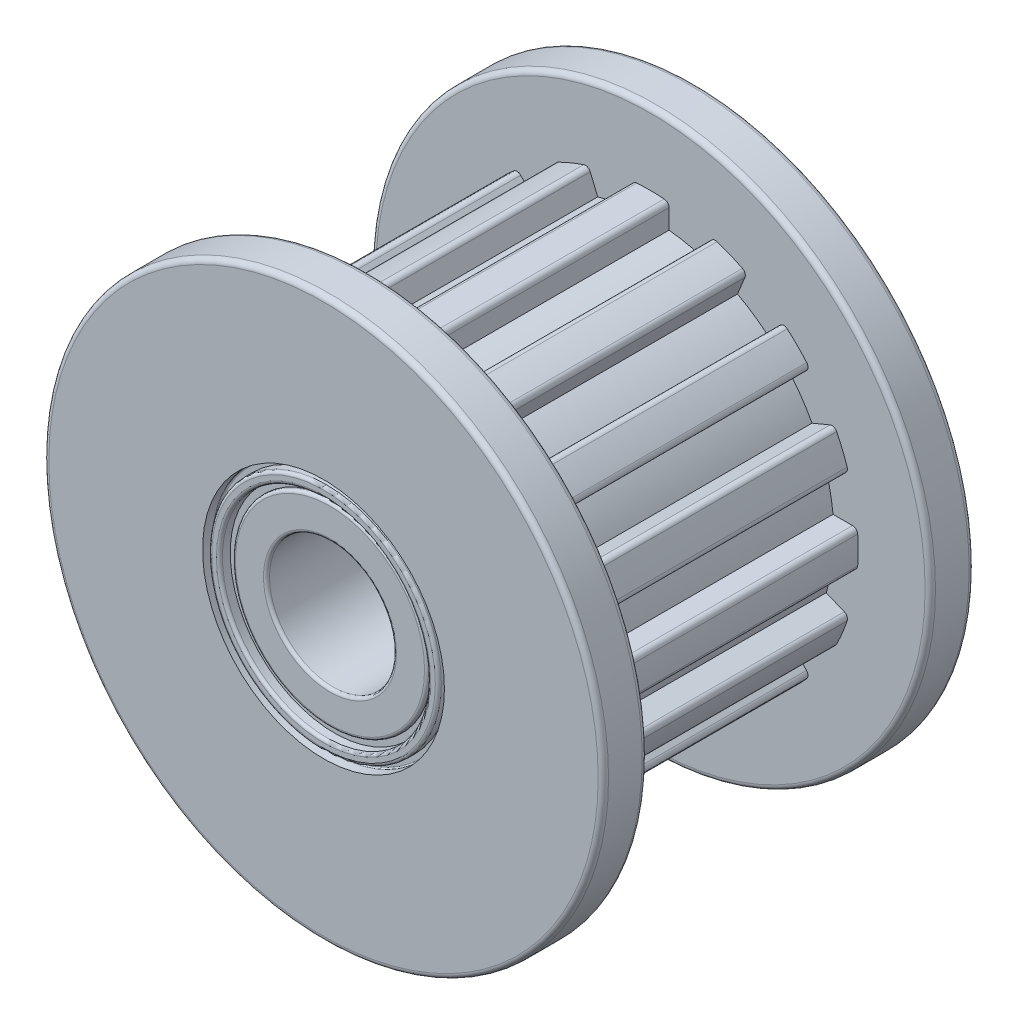
from build123d import *

# Parameters (mm, degrees)
RESSALTO_EXTRUS_O3_DEPTH   = 6.55
ESBO_O3_R                  = 6.48
RESSALTO_EXTRUS_O4_DEPTH   = 1.02
RESSALTO_EXTRUS_O5_START   = 1.02
ESBO_O4_R                  = 6.48
RESSALTO_EXTRUS_O5_DEPTH   = 1.02
FILETE2_R                  = 0.12
CORTE_EXTRUS_O1_DEPTH      = 10
CORTE_EXTRUS_O1_DEPTH_BACK = 10.02
ESBO_O5_R                  = 1.47
ESBO_O6_R                  = 2.26
CORTE_EXTRUS_O3_DEPTH      = 0.15
CORTE_EXTRUS_O4_START      = -0.15
ESBO_O8_R                  = 2.26
CORTE_EXTRUS_O4_DEPTH      = 0.15
ESBO_O9_R                  = 2.41
ESBO_O9_R_2                = 2.26
CORTE_EXTRUS_O7_DEPTH      = 0.25
CORTE_EXTRUS_O8_START      = -0.25
ESBO_O11_R                 = 2.46
ESBO_O11_R_2               = 2.26
CORTE_EXTRUS_O8_DEPTH      = 0.25
FILETE4_R                  = 0.07
FILETE5_R                  = 0.07
ESBO_O12_R                 = 2.8
ESBO_O12_R_2               = 2.66
CORTE_EXTRUS_O10_DEPTH     = 0.25
FILETE6_R                  = 0.07
FILETE7_R                  = 0.03
CORTE_EXTRUS_O11_START     = -0.25
ESBO_O13_R                 = 2.8
ESBO_O13_R_2               = 2.65
CORTE_EXTRUS_O11_DEPTH     = 0.25
FILETE8_R                  = 0.03
FILETE9_R                  = 0.07


with BuildPart() as part:
    # Esboço2 → Ressalto-extrusão3 (new body)
    with BuildSketch(Plane.XY):
        with BuildLine():
            Line((-0.43, 4.679743583), (-0.43, 4.228191103))
            ThreePointArc((-0.43, 4.228191103), (-0.829133869, 4.168337442), (-1.220790485, 4.070893095))
            Line((-1.220790485, 4.070893095), (-1.393592138, 4.488073189))
            ThreePointArc((-1.393592138, 4.488073189), (-1.454894778, 4.551437584), (-1.542951268, 4.55580963))
            ThreePointArc((-1.542951268, 4.55580963), (-1.84070731, 4.443860551), (-2.130412578, 4.312475188))
            ThreePointArc((-2.130412578, 4.312475188), (-2.189586416, 4.247118343), (-2.188128536, 4.158965438))
            Line((-2.188128536, 4.158965438), (-2.015326883, 3.741785343))
            ThreePointArc((-2.015326883, 3.741785343), (-2.36117349, 3.533745852), (-2.685726685, 3.293838517))
            Line((-2.685726685, 3.293838517), (-3.005022506, 3.613134337))
            ThreePointArc((-3.005022506, 3.613134337), (-3.085907265, 3.6482159), (-3.168933963, 3.618557384))
            ThreePointArc((-3.168933963, 3.618557384), (-3.401183618, 3.401183618), (-3.618557384, 3.168933963))
            ThreePointArc((-3.618557384, 3.168933963), (-3.6482159, 3.085907265), (-3.613134337, 3.005022506))
            Line((-3.613134337, 3.005022506), (-3.293838517, 2.685726685))
            ThreePointArc((-3.293838517, 2.685726685), (-3.533745852, 2.36117349), (-3.741785343, 2.015326883))
            Line((-3.741785343, 2.015326883), (-4.158965438, 2.188128536))
            ThreePointArc((-4.158965438, 2.188128536), (-4.247118343, 2.189586416), (-4.312475188, 2.130412578))
            ThreePointArc((-4.312475188, 2.130412578), (-4.443860551, 1.84070731), (-4.55580963, 1.542951268))
            ThreePointArc((-4.55580963, 1.542951268), (-4.551437584, 1.454894778), (-4.488073189, 1.393592138))
            Line((-4.488073189, 1.393592138), (-4.070893095, 1.220790485))
            ThreePointArc((-4.070893095, 1.220790485), (-4.168337442, 0.829133869), (-4.228191103, 0.43))
            Line((-4.228191103, 0.43), (-4.679743583, 0.43))
            ThreePointArc((-4.679743583, 0.43), (-4.761744155, 0.397612249), (-4.799481158, 0.31793177))
            ThreePointArc((-4.799481158, 0.31793177), (-4.81, 0), (-4.799481158, -0.31793177))
            ThreePointArc((-4.799481158, -0.31793177), (-4.761744155, -0.397612249), (-4.679743583, -0.43))
            Line((-4.679743583, -0.43), (-4.228191103, -0.43))
            ThreePointArc((-4.228191103, -0.43), (-4.168337442, -0.829133869), (-4.070893095, -1.220790485))
            Line((-4.070893095, -1.220790485), (-4.488073189, -1.393592138))
            ThreePointArc((-4.488073189, -1.393592138), (-4.551437584, -1.454894778), (-4.55580963, -1.542951268))
            ThreePointArc((-4.55580963, -1.542951268), (-4.443860551, -1.84070731), (-4.312475188, -2.130412578))
            ThreePointArc((-4.312475188, -2.130412578), (-4.247118343, -2.189586416), (-4.158965438, -2.188128536))
            Line((-4.158965438, -2.188128536), (-3.741785343, -2.015326883))
            ThreePointArc((-3.741785343, -2.015326883), (-3.533745852, -2.36117349), (-3.293838517, -2.685726685))
            Line((-3.293838517, -2.685726685), (-3.613134337, -3.005022506))
            ThreePointArc((-3.613134337, -3.005022506), (-3.6482159, -3.085907265), (-3.618557384, -3.168933963))
            ThreePointArc((-3.618557384, -3.168933963), (-3.401183618, -3.401183618), (-3.168933963, -3.618557384))
            ThreePointArc((-3.168933963, -3.618557384), (-3.085907265, -3.6482159), (-3.005022506, -3.613134337))
            Line((-3.005022506, -3.613134337), (-2.685726685, -3.293838517))
            ThreePointArc((-2.685726685, -3.293838517), (-2.400184002, -3.507366071), (-2.097748191, -3.696207858))
            Line((-2.097748191, -3.696207858), (-2.015326883, -3.741785343))
            Line((-2.015326883, -3.741785343), (-2.188128536, -4.158965438))
            ThreePointArc((-2.188128536, -4.158965438), (-2.189586416, -4.247118343), (-2.130412578, -4.312475188))
            ThreePointArc((-2.130412578, -4.312475188), (-1.84070731, -4.443860551), (-1.542951268, -4.55580963))
            ThreePointArc((-1.542951268, -4.55580963), (-1.454894778, -4.551437584), (-1.393592138, -4.488073189))
            Line((-1.393592138, -4.488073189), (-1.220790485, -4.070893095))
            ThreePointArc((-1.220790485, -4.070893095), (-0.829133869, -4.168337442), (-0.43, -4.228191103))
            Line((-0.43, -4.228191103), (-0.43, -4.679743583))
            ThreePointArc((-0.43, -4.679743583), (-0.397612249, -4.761744155), (-0.31793177, -4.799481158))
            ThreePointArc((-0.31793177, -4.799481158), (0, -4.81), (0.31793177, -4.799481158))
            ThreePointArc((0.31793177, -4.799481158), (0.397612249, -4.761744155), (0.43, -4.679743583))
            Line((0.43, -4.679743583), (0.43, -4.228191103))
            ThreePointArc((0.43, -4.228191103), (0.829133869, -4.168337442), (1.220790485, -4.070893095))
            Line((1.220790485, -4.070893095), (1.393592138, -4.488073189))
            ThreePointArc((1.393592138, -4.488073189), (1.454894778, -4.551437584), (1.542951268, -4.55580963))
            ThreePointArc((1.542951268, -4.55580963), (1.84070731, -4.443860551), (2.130412578, -4.312475188))
            ThreePointArc((2.130412578, -4.312475188), (2.189586416, -4.247118343), (2.188128536, -4.158965438))
            Line((2.188128536, -4.158965438), (2.015326883, -3.741785343))
            ThreePointArc((2.015326883, -3.741785343), (2.36117349, -3.533745852), (2.685726685, -3.293838517))
            Line((2.685726685, -3.293838517), (3.005022506, -3.613134337))
            ThreePointArc((3.005022506, -3.613134337), (3.085907265, -3.6482159), (3.168933963, -3.618557384))
            ThreePointArc((3.168933963, -3.618557384), (3.401183618, -3.401183618), (3.618557384, -3.168933963))
            ThreePointArc((3.618557384, -3.168933963), (3.6482159, -3.085907265), (3.613134337, -3.005022506))
            Line((3.613134337, -3.005022506), (3.293838517, -2.685726685))
            ThreePointArc((3.293838517, -2.685726685), (3.533745852, -2.36117349), (3.741785343, -2.015326883))
            Line((3.741785343, -2.015326883), (4.158965438, -2.188128536))
            ThreePointArc((4.158965438, -2.188128536), (4.247118343, -2.189586416), (4.312475188, -2.130412578))
            ThreePointArc((4.312475188, -2.130412578), (4.443860551, -1.84070731), (4.55580963, -1.542951268))
            ThreePointArc((4.55580963, -1.542951268), (4.551437584, -1.454894778), (4.488073189, -1.393592138))
            Line((4.488073189, -1.393592138), (4.070893095, -1.220790485))
            ThreePointArc((4.070893095, -1.220790485), (4.168337442, -0.829133869), (4.228191103, -0.43))
            Line((4.228191103, -0.43), (4.679743583, -0.43))
            ThreePointArc((4.679743583, -0.43), (4.761744155, -0.397612249), (4.799481158, -0.31793177))
            ThreePointArc((4.799481158, -0.31793177), (4.81, 0), (4.799481158, 0.31793177))
            ThreePointArc((4.799481158, 0.31793177), (4.761744155, 0.397612249), (4.679743583, 0.43))
            Line((4.679743583, 0.43), (4.228191103, 0.43))
            ThreePointArc((4.228191103, 0.43), (4.168337442, 0.829133869), (4.070893095, 1.220790485))
            Line((4.070893095, 1.220790485), (4.488073189, 1.393592138))
            ThreePointArc((4.488073189, 1.393592138), (4.551437584, 1.454894778), (4.55580963, 1.542951268))
            ThreePointArc((4.55580963, 1.542951268), (4.443860551, 1.84070731), (4.312475188, 2.130412578))
            ThreePointArc((4.312475188, 2.130412578), (4.247118343, 2.189586416), (4.158965438, 2.188128536))
            Line((4.158965438, 2.188128536), (3.741785343, 2.015326883))
            ThreePointArc((3.741785343, 2.015326883), (3.533745852, 2.36117349), (3.293838517, 2.685726685))
            Line((3.293838517, 2.685726685), (3.613134337, 3.005022506))
            ThreePointArc((3.613134337, 3.005022506), (3.6482159, 3.085907265), (3.618557384, 3.168933963))
            ThreePointArc((3.618557384, 3.168933963), (3.401183618, 3.401183618), (3.168933963, 3.618557384))
            ThreePointArc((3.168933963, 3.618557384), (3.085907265, 3.6482159), (3.005022506, 3.613134337))
            Line((3.005022506, 3.613134337), (2.685726685, 3.293838517))
            ThreePointArc((2.685726685, 3.293838517), (2.36117349, 3.533745852), (2.015326883, 3.741785343))
            Line((2.015326883, 3.741785343), (2.188128536, 4.158965438))
            ThreePointArc((2.188128536, 4.158965438), (2.189586416, 4.247118343), (2.130412578, 4.312475188))
            ThreePointArc((2.130412578, 4.312475188), (1.84070731, 4.443860551), (1.542951268, 4.55580963))
            ThreePointArc((1.542951268, 4.55580963), (1.454894778, 4.551437584), (1.393592138, 4.488073189))
            Line((1.393592138, 4.488073189), (1.220790485, 4.070893095))
            ThreePointArc((1.220790485, 4.070893095), (0.829133869, 4.168337442), (0.43, 4.228191103))
            Line((0.43, 4.228191103), (0.43, 4.679743583))
            ThreePointArc((0.43, 4.679743583), (0.397612249, 4.761744155), (0.31793177, 4.799481158))
            ThreePointArc((0.31793177, 4.799481158), (0, 4.81), (-0.31793177, 4.799481158))
            ThreePointArc((-0.31793177, 4.799481158), (-0.397612249, 4.761744155), (-0.43, 4.679743583))
        make_face()
    extrude(amount=RESSALTO_EXTRUS_O3_DEPTH)

    # Esboço3 → Ressalto-extrusão4 (add)
    with BuildSketch(Plane.XY.offset(6.55)):
        Circle(ESBO_O3_R)
    extrude(amount=RESSALTO_EXTRUS_O4_DEPTH)

    # Esboço4 → Ressalto-extrusão5 (add)
    with BuildSketch(Plane(origin=(0, 0, 0), x_dir=(-1, 0, 0), z_dir=(0, 0, -1)).offset(RESSALTO_EXTRUS_O5_START)):
        with Locations(Location((0, 0, 0), (0, 0, 180))):
            Circle(ESBO_O4_R)
    extrude(amount=-RESSALTO_EXTRUS_O5_DEPTH)

    # Filete2
    filete2_edges = [part.edges().sort_by_distance(p)[0] for p in [
        (-6.48, 0, 6.55),
        (-6.48, 0, 7.57),
        (-6.48, 0, 0),
        (-6.48, 0, -1.02),
    ]]
    fillet(filete2_edges, radius=FILETE2_R)

    # Esboço5 → Corte-extrusão1 (cut, two sides: drawn at the far end of the back side and taken through both)
    with BuildSketch(Plane.XY.offset(7.57).offset(-CORTE_EXTRUS_O1_DEPTH_BACK)):
        with Locations(Location((0, 0, 0), (0, 0, 180))):
            Circle(ESBO_O5_R)
    extrude(amount=CORTE_EXTRUS_O1_DEPTH + CORTE_EXTRUS_O1_DEPTH_BACK, mode=Mode.SUBTRACT)

    # Esboço6 → Corte-extrusão3 (cut)
    with BuildSketch(Plane.XY.offset(7.57)):
        Circle(ESBO_O6_R)
    extrude(amount=-CORTE_EXTRUS_O3_DEPTH, mode=Mode.SUBTRACT)

    # Esboço8 → Corte-extrusão4 (cut)
    with BuildSketch(Plane(origin=(0, 0, -1.02), x_dir=(-1, 0, 0), z_dir=(0, 0, -1)).offset(CORTE_EXTRUS_O4_START)):
        with Locations(Location((0, 0, 0), (0, 0, 180))):
            Circle(ESBO_O8_R)
    extrude(amount=CORTE_EXTRUS_O4_DEPTH, mode=Mode.SUBTRACT)

    # Esboço9 → Corte-extrusão7 (cut)
    with BuildSketch(Plane.XY.offset(7.57)):
        Circle(ESBO_O9_R)
        with Locations(Location((0, 0, 0), (0, 0, 180))):
            Circle(ESBO_O9_R_2, mode=Mode.SUBTRACT)
    extrude(amount=-CORTE_EXTRUS_O7_DEPTH, mode=Mode.SUBTRACT)

    # Esboço11 → Corte-extrusão8 (cut)
    with BuildSketch(Plane(origin=(0, 0, -1.02), x_dir=(-1, 0, 0), z_dir=(0, 0, -1)).offset(CORTE_EXTRUS_O8_START)):
        Circle(ESBO_O11_R)
        with Locations(Location((0, 0, 0), (0, 0, 180))):
            Circle(ESBO_O11_R_2, mode=Mode.SUBTRACT)
    extrude(amount=CORTE_EXTRUS_O8_DEPTH, mode=Mode.SUBTRACT)

    # Filete4
    filete4_edges = [part.edges().sort_by_distance(p)[0] for p in [
        (1.47, 0, -0.87),
        (-2.26, 0, -0.87),
    ]]
    fillet(filete4_edges, radius=FILETE4_R)

    # Filete5
    filete5_edges = [part.edges().sort_by_distance(p)[0] for p in [
        (1.47, 0, 7.42),
        (2.26, 0, 7.42),
    ]]
    fillet(filete5_edges, radius=FILETE5_R)

    # Esboço12 → Corte-extrusão10 (cut)
    with BuildSketch(Plane.XY.offset(7.57)):
        Circle(ESBO_O12_R)
        Circle(ESBO_O12_R_2, mode=Mode.SUBTRACT)
    extrude(amount=-CORTE_EXTRUS_O10_DEPTH, mode=Mode.SUBTRACT)

    # Filete6
    filete6_edges = [part.edges().sort_by_distance(p)[0] for p in [
        (-2.41, 0, 7.57),
        (-2.66, 0, 7.57),
    ]]
    fillet(filete6_edges, radius=FILETE6_R)

    # Filete7
    filete7_edges = [part.edges().sort_by_distance(p)[0] for p in [
        (-2.8, 0, 7.32),
    ]]
    fillet(filete7_edges, radius=FILETE7_R)

    # Esboço13 → Corte-extrusão11 (cut)
    with BuildSketch(Plane(origin=(0, 0, -1.02), x_dir=(-1, 0, 0), z_dir=(0, 0, -1)).offset(CORTE_EXTRUS_O11_START)):
        with Locations(Location((0, 0, 0), (0, 0, 180))):
            Circle(ESBO_O13_R)
        Circle(ESBO_O13_R_2, mode=Mode.SUBTRACT)
    extrude(amount=CORTE_EXTRUS_O11_DEPTH, mode=Mode.SUBTRACT)

    # Filete8
    filete8_edges = [part.edges().sort_by_distance(p)[0] for p in [
        (2.46, 0, -1.02),
        (2.65, 0, -1.02),
    ]]
    fillet(filete8_edges, radius=FILETE8_R)

    # Filete9
    filete9_edges = [part.edges().sort_by_distance(p)[0] for p in [
        (-2.8, 0, -1.02),
    ]]
    fillet(filete9_edges, radius=FILETE9_R)


solid = part.part
